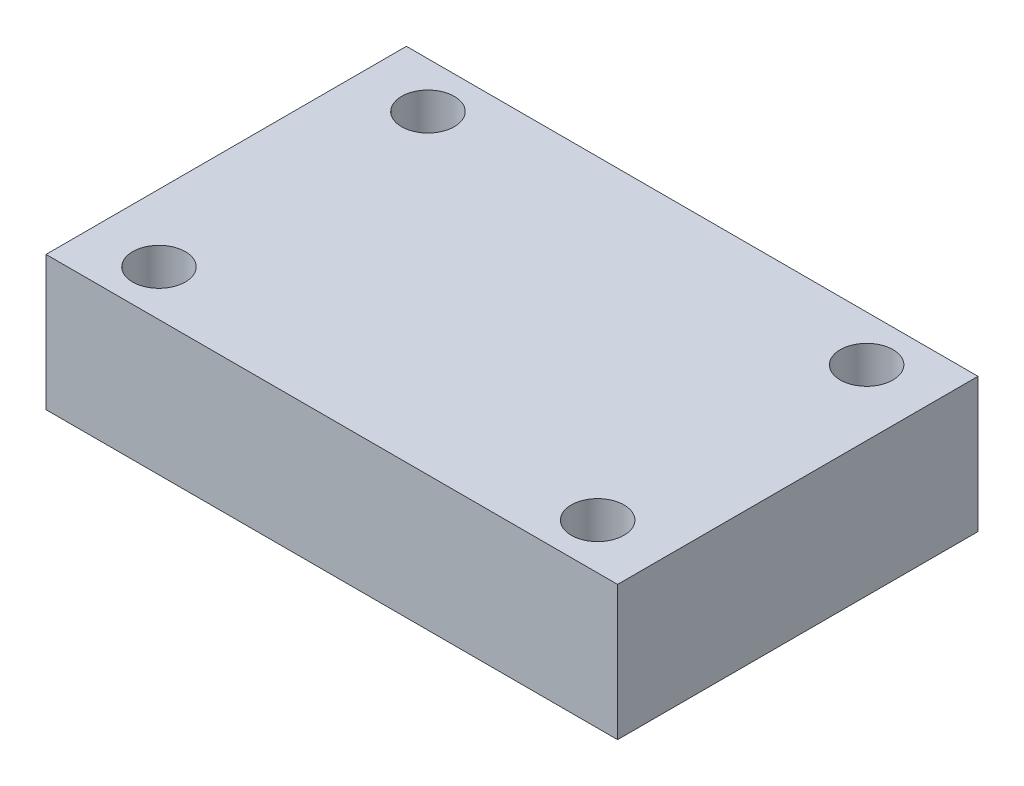
from build123d import *

# Parameters (mm, degrees)
SKETCH1_W              = 53.975
SKETCH1_H              = 34.036
BOSS_EXTRUDE1_DEPTH    = 12.7
F_10_CLEARANCE_HOLE1_D = 4.9784


with BuildPart() as part:
    # Sketch1 → Boss-Extrude1 (new body)
    with BuildSketch(Plane(origin=(0, 0, 0), x_dir=(1, 0, 0), z_dir=(0, 1, 0))):
        Rectangle(SKETCH1_W, SKETCH1_H)
    extrude(amount=BOSS_EXTRUDE1_DEPTH)

    # #10 Clearance Hole1 (through all)
    with Locations(Plane(origin=(0, 12.7, 0), x_dir=(1, 0, 0), z_dir=(0, 1, 0))):
        with Locations((-20.6375, 12.7), (-20.6375, -12.7), (20.7899, -12.7), (20.7899, 12.7)):
            Hole(F_10_CLEARANCE_HOLE1_D / 2)


solid = part.part
